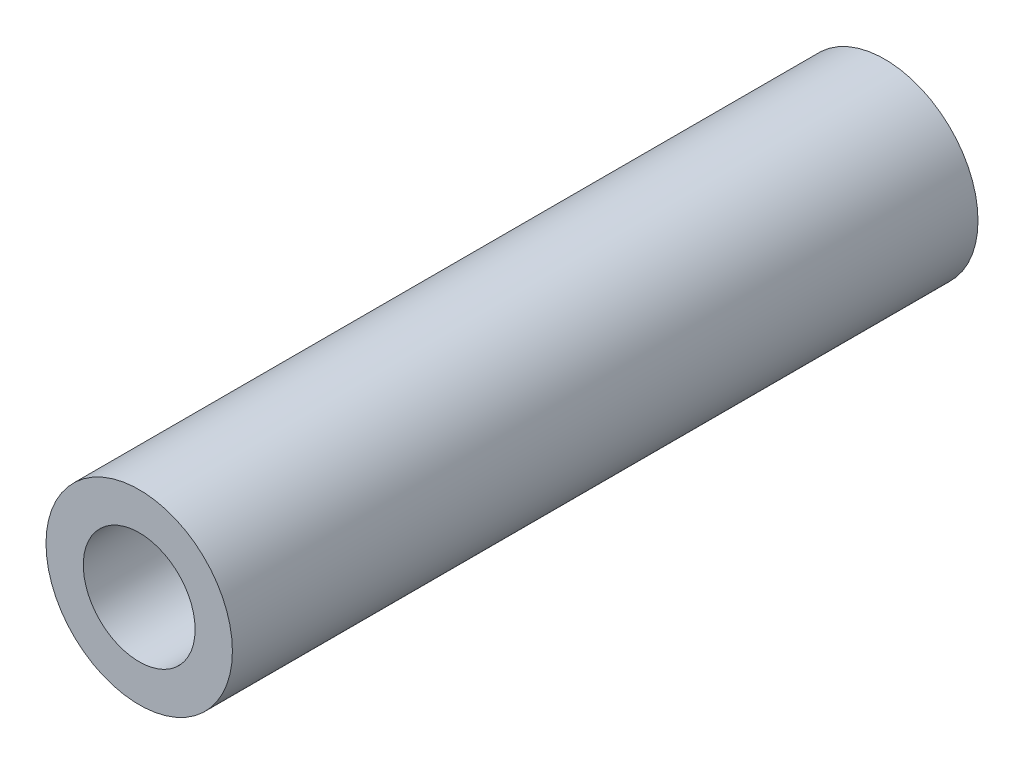
from build123d import *

# Parameters (mm, degrees)
SKETCH_1_R      = 7.5
SKETCH_1_R_2    = 4.5
EXTRUDE_1_DEPTH = 60


with BuildPart() as part:
    # 草图1 → 凸台-拉伸1 (new body)
    with BuildSketch(Plane.XY):
        Circle(SKETCH_1_R)
        Circle(SKETCH_1_R_2, mode=Mode.SUBTRACT)
    extrude(amount=EXTRUDE_1_DEPTH)


solid = part.part
